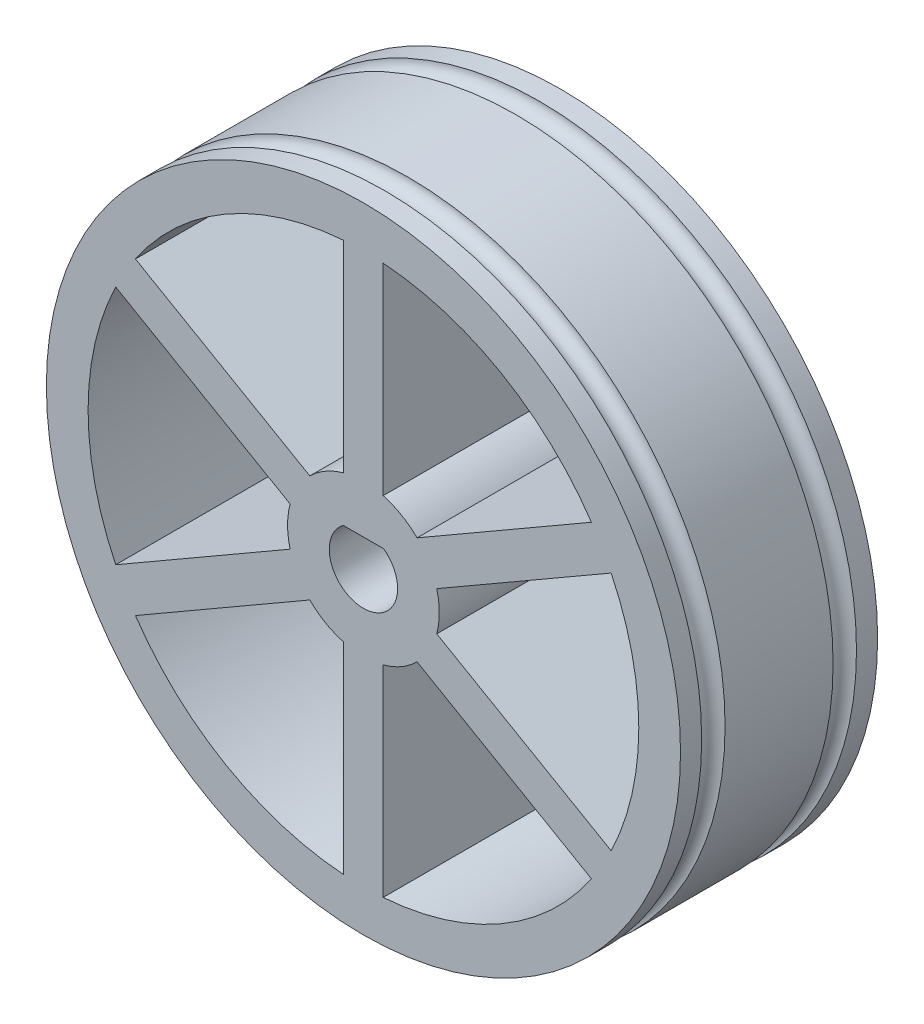
from build123d import *

# Parameters (mm, degrees)
SKETCH1_R             = 24.13
SKETCH1_R_2           = 20.955
BOSS_EXTRUDE1_DEPTH   = 15
SKETCH1_R_3           = 5.775
SKETCH1_R_4           = 2.6
BOSS_EXTRUDE1_2_DEPTH = 15
SKETCH3_W             = 3
SKETCH3_H             = 18.355
BOSS_EXTRUDE3_DEPTH   = 15
CIRPATTERN1_COUNT     = 6
SKETCH4_R             = 0.89
SKETCH5_W             = 5
SKETCH5_H             = 0.5
BOSS_EXTRUDE4_DEPTH   = 15


with BuildPart() as part:
    # Sketch1 → Boss-Extrude1 (new body)
    with BuildSketch(Plane.XY):
        Circle(SKETCH1_R)
        Circle(SKETCH1_R_2, mode=Mode.SUBTRACT)
    extrude(amount=BOSS_EXTRUDE1_DEPTH)



with BuildPart() as body_2:
    # Sketch1 → Boss-Extrude1 2 (new body)
    with BuildSketch(Plane.XY):
        Circle(SKETCH1_R_3)
        Circle(SKETCH1_R_4, mode=Mode.SUBTRACT)
    extrude(amount=BOSS_EXTRUDE1_2_DEPTH)


with BuildPart() as part_1:
    add(part.part)

    add(body_2.part)  # Boss-Extrude3 merges body 2
    # Sketch3 → Boss-Extrude3 (add)
    with BuildSketch(Plane(origin=(0, 0, 0), x_dir=(-1, 0, 0), z_dir=(0, 0, -1))):
        with Locations((0, 11.7775)):
            Rectangle(SKETCH3_W, SKETCH3_H)
    boss_extrude3 = extrude(amount=-BOSS_EXTRUDE3_DEPTH)

    # CirPattern1: Boss-Extrude3 ×6 about axis
    cirpattern1_axis = Axis((0, 0, 0), (0, 0, 1))
    for i in range(1, CIRPATTERN1_COUNT):
        add(boss_extrude3.rotate(cirpattern1_axis, i * 360 / CIRPATTERN1_COUNT))

    # Sketch4 → Cut-Revolve1 (revolve, cut)
    with BuildSketch(Plane(origin=(0, 0, 0), x_dir=(0, 0, -1), z_dir=(1, 0, 0)), mode=Mode.PRIVATE) as cut_revolve1_sk:
        with Locations((-12.5, 24.13)):
            Circle(SKETCH4_R)
        with Locations((-2.5, 24.13)):
            Circle(SKETCH4_R)
    revolve(cut_revolve1_sk.sketch.rotate(Axis((0, 0, 0), (0, 0, 1)), 90), axis=Axis((0, 0, 0), (0, 0, 1)), mode=Mode.SUBTRACT)

    # Sketch5 → Boss-Extrude4 (add)
    with BuildSketch(Plane.XY.offset(15)):
        with Locations((0, 2.35)):
            Rectangle(SKETCH5_W, SKETCH5_H)
    extrude(amount=-BOSS_EXTRUDE4_DEPTH)


solid = part_1.part
